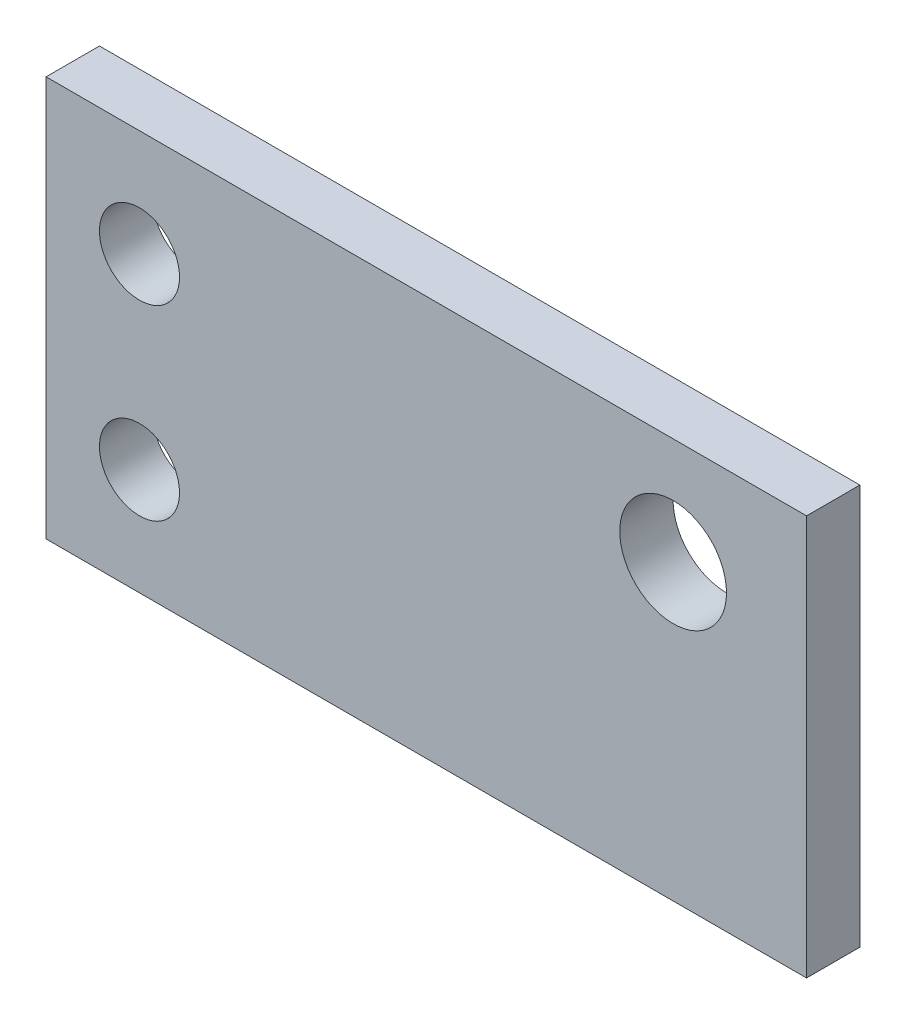
from build123d import *

# Parameters (mm, degrees)
ESQUISSE1_W      = 28.5
ESQUISSE1_H      = 15
ESQUISSE1_R      = 1.5
ESQUISSE1_R_2    = 2
EXTRUSION1_DEPTH = 2


with BuildPart() as part:
    # Esquisse1 → Extrusion1 (new body)
    with BuildSketch(Plane.XY):
        with Locations((-11.704054801, 2.500210526)):
            Rectangle(ESQUISSE1_W, ESQUISSE1_H)
        with Locations((-22.454054801, -0.999789474)):
            Circle(ESQUISSE1_R, mode=Mode.SUBTRACT)
        with Locations((-22.454054801, 6.000210526)):
            Circle(ESQUISSE1_R, mode=Mode.SUBTRACT)
        with Locations((-2.454054801, 6.000210526)):
            Circle(ESQUISSE1_R_2, mode=Mode.SUBTRACT)
    extrude(amount=EXTRUSION1_DEPTH)


solid = part.part
